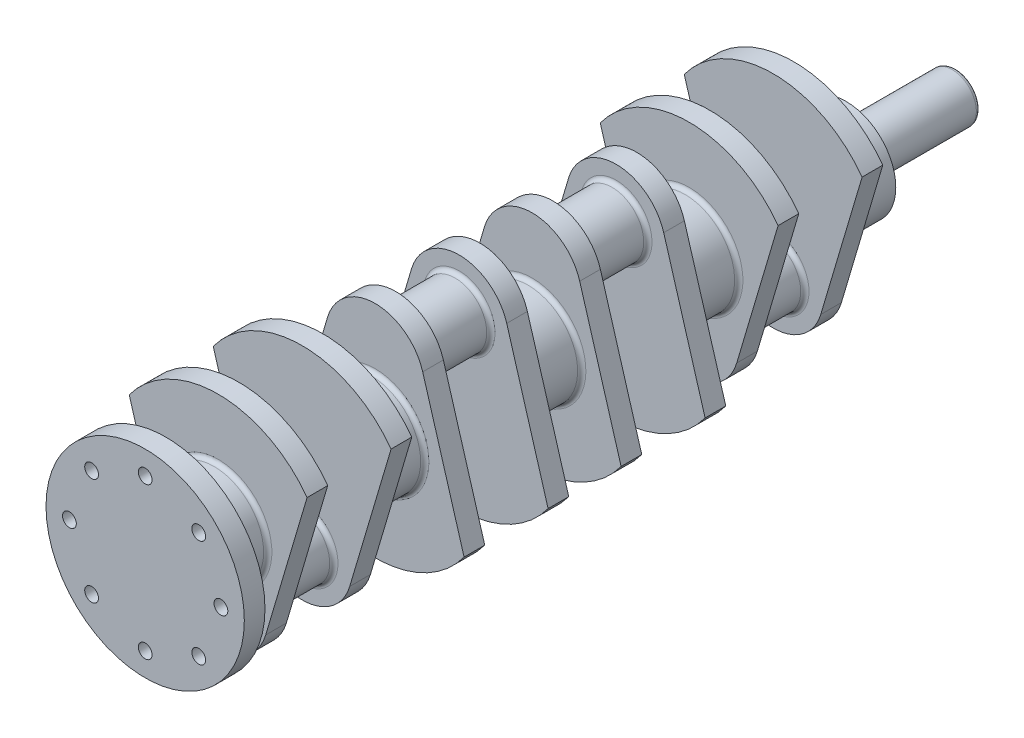
from build123d import *

# Parameters (mm, degrees)
SKETCH1_R             = 36
BOSS_EXTRUDE1_DEPTH   = 15
SKETCH2_R             = 23
BOSS_EXTRUDE2_DEPTH   = 46
SKETCH3_R             = 36
BOSS_EXTRUDE3_DEPTH   = 38
BODY_MOVE_COPY1_ANGLE = 180
SKETCH4_R             = 17.5
BOSS_EXTRUDE4_DEPTH   = 80
SKETCH5_R             = 72
SKETCH5_R_2           = 5
BOSS_EXTRUDE5_DEPTH   = 15
FILLET1_R             = 3


with BuildPart() as part:
    # Sketch1 → Boss-Extrude1 (new body)
    with BuildSketch(Plane.XY):
        with BuildLine():
            ThreePointArc((64.569893475, 47.23059238), (0, 80), (-64.569893475, 47.23059238))
            Line((-64.569893475, 47.23059238), (-34.517510455, -54.224552409))
            ThreePointArc((-34.517510455, -54.224552409), (-5.165734392, -8.372550074), (36, -44))
            ThreePointArc((36, -44), (35.627449926, -49.165734392), (34.517510455, -54.224552409))
            Line((34.517510455, -54.224552409), (64.569893475, 47.23059238))
        make_face()
        with Locations((0, -44)):
            Circle(SKETCH1_R)
    boss_extrude1 = extrude(amount=BOSS_EXTRUDE1_DEPTH)

    # Sketch2 → Boss-Extrude2 (add)
    with BuildSketch(Plane.XY.offset(15)):
        with Locations((0, -44)):
            Circle(SKETCH2_R)
    extrude(amount=BOSS_EXTRUDE2_DEPTH)

    # Sketch3 → Boss-Extrude3 (add)
    with BuildSketch(Plane(origin=(0, 0, 0), x_dir=(-1, 0, 0), z_dir=(0, 0, -1))):
        Circle(SKETCH3_R)
    boss_extrude3 = extrude(amount=BOSS_EXTRUDE3_DEPTH)

    # Mirror1: Boss-Extrude1, Boss-Extrude3 across plane
    add(boss_extrude1.mirror(Plane.XY.offset(38)))
    add(boss_extrude3.mirror(Plane.XY.offset(38)))


with BuildPart() as body_2:
    # Mirror2: mirrored copy
    add(part.part.mirror(Plane.XY.offset(95)))


with BuildPart() as body_2_1:
    # Body-Move/Copy1: moved
    add(body_2.part.rotate(Axis((0, 0, 152), (1, 0, 0)), BODY_MOVE_COPY1_ANGLE))


with BuildPart() as body_3:
    # Mirror3: mirrored copy
    add(body_2_1.part.mirror(Plane.XY.offset(209)))


with BuildPart() as body_4:
    # Mirror3 2: mirrored copy
    add(part.part.mirror(Plane.XY.offset(209)))

    # Sketch5 → Boss-Extrude5 (add)
    with BuildSketch(Plane.XY.offset(456)):
        Circle(SKETCH5_R)
        with Locations((0, 55)):
            Circle(SKETCH5_R_2, mode=Mode.SUBTRACT)
        with Locations((38.890872965, 38.890872965)):
            Circle(SKETCH5_R_2, mode=Mode.SUBTRACT)
        with Locations((55, 0)):
            Circle(SKETCH5_R_2, mode=Mode.SUBTRACT)
        with Locations((38.890872965, -38.890872965)):
            Circle(SKETCH5_R_2, mode=Mode.SUBTRACT)
        with Locations((0, -55)):
            Circle(SKETCH5_R_2, mode=Mode.SUBTRACT)
        with Locations((-38.890872965, -38.890872965)):
            Circle(SKETCH5_R_2, mode=Mode.SUBTRACT)
        with Locations((-55, 0)):
            Circle(SKETCH5_R_2, mode=Mode.SUBTRACT)
        with Locations((-38.890872965, 38.890872965)):
            Circle(SKETCH5_R_2, mode=Mode.SUBTRACT)
    extrude(amount=BOSS_EXTRUDE5_DEPTH)


with BuildPart() as part_1:
    add(part.part)

    # Sketch4 → Boss-Extrude4 (add)
    with BuildSketch(Plane(origin=(0, 0, -38), x_dir=(-1, 0, 0), z_dir=(0, 0, -1))):
        Circle(SKETCH4_R)
    extrude(amount=BOSS_EXTRUDE4_DEPTH)

    # Combine1: union body 2, body 3, body 4
    add(body_2_1.part)
    add(body_3.part)
    add(body_4.part)

    # Fillet1
    fillet1_edges = [part_1.edges().sort_by_distance(p)[0] for p in [
        (-23, -44, 15),
        (-23, -44, 61),
        (36, 0, 0),
        (36, 0, 76),
        (17.5, 0, -38),
        (17.5, 0, -118),
        (-23, 44, 129),
        (36, 0, 114),
        (-23, 44, 175),
        (36, 0, 190),
        (-23, 44, 289),
        (36, 0, 304),
        (-23, 44, 243),
        (36, 0, 228),
        (-23, -44, 403),
        (36, 0, 418),
        (-23, -44, 357),
        (36, 0, 456),
        (36, 0, 342),
    ]]
    fillet(fillet1_edges, radius=FILLET1_R)


solid = part_1.part
